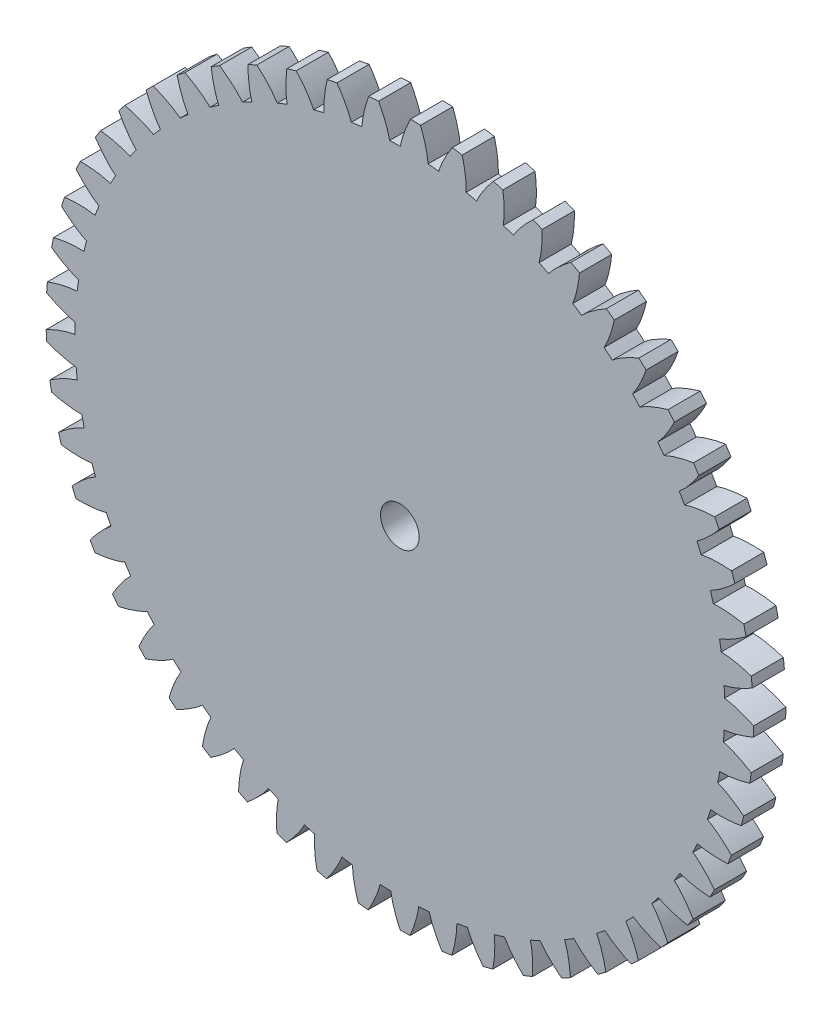
from build123d import *

# Parameters (mm, degrees)
EXTRUDE_1_DEPTH     = 5
SKETCH_3_R          = 3
CUT_EXTRUDE_1_DEPTH = 10


with BuildPart() as part:
    # 草图2 → 凸台-拉伸1 (new body)
    with BuildSketch(Plane.XY):
        with BuildLine():
            ThreePointArc((6.050445487, 50.136235493), (5.224631296, 50.229007832), (4.39740234, 50.308178785))
            add(Edge.make_bspline(
                [(4.39740234, 50.308178785), (4.39433391, 50.347031472), (4.379480718, 50.521134839), (4.321791187, 51.034505691), (4.196292667, 51.746210415), (3.988817446, 52.610724903), (3.696242823, 53.584892052), (3.473195651, 54.222326614), (3.305652379, 54.661100667), (3.207731405, 54.90637904)],
                knots=[0.023341811, 0.023341811, 0.023341811, 0.023341811, 0.023341811, 0.02853182, 0.046610139, 0.092110525, 0.119476175, 0.146842495, 0.182010624, 0.182010624, 0.182010624, 0.182010624, 0.182010624], degree=4))
            ThreePointArc((3.207731405, 54.90637904), (2.43944874, 54.945874184), (1.670688816, 54.974619588))
            add(Edge.make_bspline(
                [(0.078206442, 50.499939443), (0.084705921, 50.538367341), (0.114929701, 50.710469412), (0.217887143, 51.216707971), (0.405963113, 51.914490833), (0.689235239, 52.757217461), (1.066989355, 53.70162382), (1.345648358, 54.31678398), (1.551416558, 54.73898401), (1.670688816, 54.974619588)],
                knots=[0.023341811, 0.023341811, 0.023341811, 0.023341811, 0.023341811, 0.02853182, 0.046610139, 0.092110525, 0.119476175, 0.146842495, 0.182010624, 0.182010624, 0.182010624, 0.182010624, 0.182010624], degree=4))
            ThreePointArc((0.078206442, 50.499939443), (-0.752783918, 50.494388959), (-1.583570433, 50.475165227))
            add(Edge.make_bspline(
                [(-1.583570433, 50.475165227), (-1.591212556, 50.513382298), (-1.626553252, 50.684506916), (-1.744555864, 51.187451344), (-1.953349097, 51.879317572), (-2.261616939, 52.713225364), (-2.667355847, 53.645951198), (-2.964228879, 54.252531172), (-3.182491379, 54.668409639), (-3.308734907, 54.900385002)],
                knots=[0.023341811, 0.023341811, 0.023341811, 0.023341811, 0.023341811, 0.02853182, 0.046610139, 0.092110525, 0.119476175, 0.146842495, 0.182010624, 0.182010624, 0.182010624, 0.182010624, 0.182010624], degree=4))
            ThreePointArc((-3.308734907, 54.900385002), (-4.076296285, 54.848735706), (-4.843060167, 54.786355676))
            add(Edge.make_bspline(
                [(-5.895130451, 50.154734941), (-5.89322158, 50.193661831), (-5.883564995, 50.368130596), (-5.841204642, 50.882993019), (-5.736977751, 51.598122551), (-5.555365835, 52.468437655), (-5.291961073, 53.450893493), (-5.088014895, 54.094693786), (-4.933625898, 54.538267293), (-4.843060167, 54.786355676)],
                knots=[0.023341811, 0.023341811, 0.023341811, 0.023341811, 0.023341811, 0.02853182, 0.046610139, 0.092110525, 0.119476175, 0.146842495, 0.182010624, 0.182010624, 0.182010624, 0.182010624, 0.182010624], degree=4))
            ThreePointArc((-5.895130451, 50.154734941), (-6.719631696, 50.05093955), (-7.542313348, 49.933590992))
            add(Edge.make_bspline(
                [(-7.542313348, 49.933590992), (-7.554421887, 49.970635963), (-7.609753981, 50.136379618), (-7.786413176, 50.621837383), (-8.075570122, 51.284152832), (-8.480303181, 52.07574769), (-8.993510687, 52.953938784), (-9.360042134, 53.521149116), (-9.625959935, 53.908293973), (-9.778753833, 54.123709901)],
                knots=[0.023341811, 0.023341811, 0.023341811, 0.023341811, 0.023341811, 0.02853182, 0.046610139, 0.092110525, 0.119476175, 0.146842495, 0.182010624, 0.182010624, 0.182010624, 0.182010624, 0.182010624], degree=4))
            ThreePointArc((-9.778753833, 54.123709901), (-10.534819046, 53.98164121), (-11.288823202, 53.829011422))
            add(Edge.make_bspline(
                [(-11.785712635, 49.1054679), (-11.788421168, 49.144347334), (-11.799467337, 49.318733635), (-11.818298718, 49.834992381), (-11.799384022, 50.557429733), (-11.72198175, 51.443115995), (-11.576623969, 52.449829787), (-11.450253571, 53.113232669), (-11.34941106, 53.571952852), (-11.288823202, 53.829011422)],
                knots=[0.023341811, 0.023341811, 0.023341811, 0.023341811, 0.023341811, 0.02853182, 0.046610139, 0.092110525, 0.119476175, 0.146842495, 0.182010624, 0.182010624, 0.182010624, 0.182010624, 0.182010624], degree=4))
            ThreePointArc((-11.785712635, 49.1054679), (-12.592150574, 48.904884663), (-13.395178717, 48.691058595))
            add(Edge.make_bspline(
                [(-13.395178717, 48.691058595), (-13.411583693, 48.726411436), (-13.486130444, 48.88444745), (-13.718966315, 49.345603791), (-14.084427844, 49.969071002), (-14.579944554, 50.707240669), (-15.193416352, 51.518569145), (-15.624460914, 52.038447446), (-15.934301114, 52.391424029), (-16.111500491, 52.587256555)],
                knots=[0.023341811, 0.023341811, 0.023341811, 0.023341811, 0.023341811, 0.02853182, 0.046610139, 0.092110525, 0.119476175, 0.146842495, 0.182010624, 0.182010624, 0.182010624, 0.182010624, 0.182010624], degree=4))
            ThreePointArc((-16.111500491, 52.587256555), (-16.84545604, 52.356762799), (-17.576115904, 52.116025843))
            add(Edge.make_bspline(
                [(-17.510849248, 47.366867731), (-17.518137164, 47.405153927), (-17.549731021, 47.577009762), (-17.629489786, 48.08741769), (-17.696152807, 48.807021424), (-17.724046737, 49.695645752), (-17.69877644, 50.712485442), (-17.651755786, 51.386178191), (-17.60587537, 51.853605624), (-17.576115904, 52.116025843)],
                knots=[0.023341811, 0.023341811, 0.023341811, 0.023341811, 0.023341811, 0.02853182, 0.046610139, 0.092110525, 0.119476175, 0.146842495, 0.182010624, 0.182010624, 0.182010624, 0.182010624, 0.182010624], degree=4))
            ThreePointArc((-17.510849248, 47.366867731), (-18.287903261, 47.072312396), (-19.060005139, 46.765010468))
            add(Edge.make_bspline(
                [(-19.060005139, 46.765010468), (-19.080476263, 46.798174902), (-19.173191198, 46.946284795), (-19.458935239, 47.376666088), (-19.895571072, 47.952532948), (-20.474915466, 48.626915141), (-21.180039756, 49.359991725), (-21.669546512, 49.825240043), (-22.018959633, 50.139093335), (-22.218076998, 50.312593399)],
                knots=[0.023341811, 0.023341811, 0.023341811, 0.023341811, 0.023341811, 0.02853182, 0.046610139, 0.092110525, 0.119476175, 0.146842495, 0.182010624, 0.182010624, 0.182010624, 0.182010624, 0.182010624], degree=4))
            ThreePointArc((-22.218076998, 50.312593399), (-22.919619757, 49.996910207), (-23.616678467, 49.671445501))
            add(Edge.make_bspline(
                [(-22.990171921, 44.963340568), (-23.001936914, 45.000496072), (-23.053634952, 45.167408962), (-23.193201461, 45.664801064), (-23.344506396, 46.371469521), (-23.477304959, 47.250557577), (-23.572476886, 48.263248965), (-23.605466043, 48.937774411), (-23.615191782, 49.407347438), (-23.616678467, 49.671445501)],
                knots=[0.023341811, 0.023341811, 0.023341811, 0.023341811, 0.023341811, 0.02853182, 0.046610139, 0.092110525, 0.119476175, 0.146842495, 0.182010624, 0.182010624, 0.182010624, 0.182010624, 0.182010624], degree=4))
            ThreePointArc((-22.990171921, 44.963340568), (-23.726933874, 44.578948047), (-24.45727087, 44.182484104))
            add(Edge.make_bspline(
                [(-24.45727087, 44.182484104), (-24.481520771, 44.212994575), (-24.591102376, 44.34909921), (-24.925743367, 44.742663844), (-25.427424095, 45.262846446), (-26.082463446, 45.863974316), (-26.869341828, 46.508508221), (-27.410439178, 46.912595489), (-27.794520225, 47.182919677), (-28.012760408, 47.331651718)],
                knots=[0.023341811, 0.023341811, 0.023341811, 0.023341811, 0.023341811, 0.02853182, 0.046610139, 0.092110525, 0.119476175, 0.146842495, 0.182010624, 0.182010624, 0.182010624, 0.182010624, 0.182010624], degree=4))
            ThreePointArc((-28.012760408, 47.331651718), (-28.672042253, 46.935210589), (-29.325714632, 46.529586946))
            add(Edge.make_bspline(
                [(-28.146762976, 41.928626665), (-28.162839891, 41.964129895), (-28.233916382, 42.123756748), (-28.431331428, 42.601150729), (-28.665154288, 43.284963834), (-28.900993282, 44.142175148), (-29.115271428, 45.136502267), (-29.227807301, 45.802391551), (-29.293002667, 46.267518396), (-29.325714632, 46.529586946)],
                knots=[0.023341811, 0.023341811, 0.023341811, 0.023341811, 0.023341811, 0.02853182, 0.046610139, 0.092110525, 0.119476175, 0.146842495, 0.182010624, 0.182010624, 0.182010624, 0.182010624, 0.182010624], degree=4))
            ThreePointArc((-28.146762976, 41.928626665), (-28.832890345, 41.459792985), (-29.511210128, 40.979732513))
            add(Edge.make_bspline(
                [(-29.511210128, 40.979732513), (-29.538898392, 41.007160721), (-29.66380838, 41.129349487), (-30.042648695, 41.480572677), (-30.602331821, 41.937768796), (-31.323870813, 42.457203827), (-32.18145724, 43.004147208), (-32.766549361, 43.341400928), (-33.17990668, 43.564401253), (-33.414206066, 43.686277399)],
                knots=[0.023341811, 0.023341811, 0.023341811, 0.023341811, 0.023341811, 0.02853182, 0.046610139, 0.092110525, 0.119476175, 0.146842495, 0.182010624, 0.182010624, 0.182010624, 0.182010624, 0.182010624], degree=4))
            ThreePointArc((-33.414206066, 43.686277399), (-34.021972125, 43.214643499), (-34.623082046, 42.734554983))
            add(Edge.make_bspline(
                [(-32.908235177, 38.305326751), (-32.92839833, 38.33867932), (-33.017855515, 38.488779326), (-33.270347825, 38.939473621), (-33.583406248, 39.590832136), (-33.918975011, 40.414133341), (-34.249351381, 41.376138017), (-34.439854212, 42.024043514), (-34.559604005, 42.478194816), (-34.623082046, 42.734554983)],
                knots=[0.023341811, 0.023341811, 0.023341811, 0.023341811, 0.023341811, 0.02853182, 0.046610139, 0.092110525, 0.119476175, 0.146842495, 0.182010624, 0.182010624, 0.182010624, 0.182010624, 0.182010624], degree=4))
            ThreePointArc((-32.908235177, 38.305326751), (-33.534096238, 37.758633311), (-34.150876685, 37.201715305))
            add(Edge.make_bspline(
                [(-34.150876685, 37.201715305), (-34.181614629, 37.225676219), (-34.320099539, 37.332233853), (-34.737821091, 37.636185196), (-35.347649889, 38.023976802), (-36.125559696, 38.454427263), (-37.041815534, 38.896102235), (-37.662689017, 39.161788103), (-38.099519976, 39.334334129), (-38.346589515, 39.427643507)],
                knots=[0.023341811, 0.023341811, 0.023341811, 0.023341811, 0.023341811, 0.02853182, 0.046610139, 0.092110525, 0.119476175, 0.146842495, 0.182010624, 0.182010624, 0.182010624, 0.182010624, 0.182010624], degree=4))
            ThreePointArc((-38.346589515, 39.427643507), (-38.894308086, 38.887437541), (-39.434417283, 38.339623544))
            add(Edge.make_bspline(
                [(-37.207747892, 34.144304017), (-37.231714235, 34.175037727), (-37.338296333, 34.313503811), (-37.642321467, 34.731171659), (-38.0302208, 35.340931939), (-38.460808682, 36.11876569), (-38.902645515, 37.034943487), (-39.168441063, 37.655770024), (-39.341064258, 38.092570493), (-39.434417283, 38.339623544)],
                knots=[0.023341811, 0.023341811, 0.023341811, 0.023341811, 0.023341811, 0.02853182, 0.046610139, 0.092110525, 0.119476175, 0.146842495, 0.182010624, 0.182010624, 0.182010624, 0.182010624, 0.182010624], degree=4))
            ThreePointArc((-37.207747892, 34.144304017), (-37.764556927, 33.527425193), (-38.311139793, 32.901467562))
            add(Edge.make_bspline(
                [(-38.311139793, 32.901467562), (-38.344495924, 32.921624822), (-38.494611731, 33.011055489), (-38.945350624, 33.263468174), (-39.596764435, 33.576411522), (-40.420124909, 33.911834834), (-41.382187936, 34.242041248), (-42.030127077, 34.432429617), (-42.484299527, 34.552099176), (-42.740670905, 34.615531927)],
                knots=[0.023341811, 0.023341811, 0.023341811, 0.023341811, 0.023341811, 0.02853182, 0.046610139, 0.092110525, 0.119476175, 0.146842495, 0.182010624, 0.182010624, 0.182010624, 0.182010624, 0.182010624], degree=4))
            ThreePointArc((-42.740670905, 34.615531927), (-43.220653219, 34.014337202), (-43.692179743, 33.406487832))
            add(Edge.make_bspline(
                [(-40.984945387, 29.503970099), (-41.012378486, 29.531653517), (-41.134589317, 29.656541918), (-41.485879428, 30.035320179), (-41.943174416, 30.594922526), (-42.462736907, 31.316369743), (-43.009831783, 32.173859532), (-43.34718886, 32.758892065), (-43.570262207, 33.172209981), (-43.692179743, 33.406487832)],
                knots=[0.023341811, 0.023341811, 0.023341811, 0.023341811, 0.023341811, 0.02853182, 0.046610139, 0.092110525, 0.119476175, 0.146842495, 0.182010624, 0.182010624, 0.182010624, 0.182010624, 0.182010624], degree=4))
            ThreePointArc((-40.984945387, 29.503970099), (-41.464886019, 28.825565518), (-41.933598478, 28.139355335))
            add(Edge.make_bspline(
                [(-41.933598478, 28.139355335), (-41.969104548, 28.155425978), (-42.128743955, 28.226474267), (-42.606172804, 28.423804974), (-43.290027206, 28.657507026), (-44.147280171, 28.893194579), (-45.141645129, 29.107297062), (-45.807554284, 29.219715295), (-46.272692639, 29.28482849), (-46.534766964, 29.317494157)],
                knots=[0.023341811, 0.023341811, 0.023341811, 0.023341811, 0.023341811, 0.02853182, 0.046610139, 0.092110525, 0.119476175, 0.146842495, 0.182010624, 0.182010624, 0.182010624, 0.182010624, 0.182010624], degree=4))
            ThreePointArc((-46.534766964, 29.317494157), (-46.940275122, 28.66375013), (-47.336599774, 28.004398259))
            add(Edge.make_bspline(
                [(-44.186804089, 24.449465115), (-44.217318843, 24.473709626), (-44.353442835, 24.583267184), (-44.747066581, 24.917838642), (-45.267337803, 25.419427466), (-45.868581385, 26.07436061), (-46.513254291, 26.861125116), (-46.917437144, 27.40215107), (-47.18782918, 27.786184355), (-47.336599774, 28.004398259)],
                knots=[0.023341811, 0.023341811, 0.023341811, 0.023341811, 0.023341811, 0.02853182, 0.046610139, 0.092110525, 0.119476175, 0.146842495, 0.182010624, 0.182010624, 0.182010624, 0.182010624, 0.182010624], degree=4))
            ThreePointArc((-44.186804089, 24.449465115), (-44.583139002, 23.71905809), (-44.96740136, 22.982228242))
            add(Edge.make_bspline(
                [(-44.96740136, 22.982228242), (-45.004558942, 22.993986671), (-45.171480962, 23.04565522), (-45.668897712, 23.185133857), (-46.375592889, 23.336313948), (-47.254704391, 23.468957207), (-48.267412576, 23.563950228), (-48.94194384, 23.596820222), (-49.411518578, 23.606463005), (-49.6756169, 23.607903034)],
                knots=[0.023341811, 0.023341811, 0.023341811, 0.023341811, 0.023341811, 0.02853182, 0.046610139, 0.092110525, 0.119476175, 0.146842495, 0.182010624, 0.182010624, 0.182010624, 0.182010624, 0.182010624], degree=4))
            ThreePointArc((-49.6756169, 23.607903034), (-50.000958456, 22.910786837), (-50.316517707, 22.20918832))
            add(Edge.make_bspline(
                [(-46.76837692, 19.051743234), (-46.80154497, 19.072208499), (-46.94967124, 19.164897267), (-47.380103006, 19.450565271), (-47.956046995, 19.887099364), (-48.630531525, 20.466324611), (-49.363732667, 21.171319383), (-49.829067455, 21.66074394), (-50.14298247, 22.010101609), (-50.316517707, 22.20918832)],
                knots=[0.023341811, 0.023341811, 0.023341811, 0.023341811, 0.023341811, 0.02853182, 0.046610139, 0.092110525, 0.119476175, 0.146842495, 0.182010624, 0.182010624, 0.182010624, 0.182010624, 0.182010624], degree=4))
            ThreePointArc((-46.76837692, 19.051743234), (-47.075542442, 18.27958708), (-47.369960496, 17.502481041))
            add(Edge.make_bspline(
                [(-47.369960496, 17.502481041), (-47.408247979, 17.509762194), (-47.580109393, 17.54132569), (-48.090531403, 17.620994284), (-48.810146903, 17.687530177), (-49.698776145, 17.71526712), (-50.715611355, 17.689817187), (-51.389295786, 17.642677517), (-51.856715107, 17.596714526), (-52.119130065, 17.566908701)],
                knots=[0.023341811, 0.023341811, 0.023341811, 0.023341811, 0.023341811, 0.02853182, 0.046610139, 0.092110525, 0.119476175, 0.146842495, 0.182010624, 0.182010624, 0.182010624, 0.182010624, 0.182010624], degree=4))
            ThreePointArc((-52.119130065, 17.566908701), (-52.359737937, 16.836206318), (-52.590102026, 16.102210061))
            add(Edge.make_bspline(
                [(-48.693424257, 13.386576641), (-48.728779995, 13.402975371), (-48.886829176, 13.477494202), (-49.348026643, 13.7102486), (-49.971558407, 14.07559998), (-50.709815602, 14.570986276), (-51.521252443, 15.184314734), (-52.041206885, 15.615267446), (-52.3942382, 15.925045283), (-52.590102026, 16.102210061)],
                knots=[0.023341811, 0.023341811, 0.023341811, 0.023341811, 0.023341811, 0.02853182, 0.046610139, 0.092110525, 0.119476175, 0.146842495, 0.182010624, 0.182010624, 0.182010624, 0.182010624, 0.182010624], degree=4))
            ThreePointArc((-48.693424257, 13.386576641), (-48.907108456, 12.583510736), (-49.107549223, 11.777037373))
            add(Edge.make_bspline(
                [(-49.107549223, 11.777037373), (-49.146429135, 11.779739038), (-49.320817385, 11.790754399), (-49.83707945, 11.809494576), (-50.559513448, 11.790452254), (-51.445186023, 11.712893516), (-52.45187412, 11.567357888), (-53.115254667, 11.440870294), (-53.573957027, 11.339946747), (-53.83100489, 11.279313477)],
                knots=[0.023341811, 0.023341811, 0.023341811, 0.023341811, 0.023341811, 0.02853182, 0.046610139, 0.092110525, 0.119476175, 0.146842495, 0.182010624, 0.182010624, 0.182010624, 0.182010624, 0.182010624], degree=4))
            ThreePointArc((-53.83100489, 11.279313477), (-53.983501471, 10.525282368), (-54.125436592, 9.769192069))
            add(Edge.make_bspline(
                [(-49.934922654, 7.533491855), (-49.971969763, 7.545593849), (-50.137723191, 7.600896661), (-50.623212158, 7.777470092), (-51.285578679, 8.066510027), (-52.077245026, 8.471103234), (-52.95552677, 8.98415559), (-53.522801846, 9.350586826), (-53.909993675, 9.616436229), (-54.125436592, 9.769192069)],
                knots=[0.023341811, 0.023341811, 0.023341811, 0.023341811, 0.023341811, 0.02853182, 0.046610139, 0.092110525, 0.119476175, 0.146842495, 0.182010624, 0.182010624, 0.182010624, 0.182010624, 0.182010624], degree=4))
            ThreePointArc((-49.934922654, 7.533491855), (-50.052125874, 6.710789484), (-50.155775604, 5.886269916))
            add(Edge.make_bspline(
                [(-50.155775604, 5.886269916), (-50.194702157, 5.884354167), (-50.369169213, 5.874666761), (-50.884024144, 5.832215452), (-51.599135252, 5.727862226), (-52.469418259, 5.546096561), (-53.451827548, 5.282518241), (-54.095591802, 5.07845833), (-54.539138027, 4.923990973), (-54.787210406, 4.833381416)],
                knots=[0.023341811, 0.023341811, 0.023341811, 0.023341811, 0.023341811, 0.02853182, 0.046610139, 0.092110525, 0.119476175, 0.146842495, 0.182010624, 0.182010624, 0.182010624, 0.182010624, 0.182010624], degree=4))
            ThreePointArc((-54.787210406, 4.833381416), (-54.849454978, 4.066606526), (-54.900968673, 3.299036035))
            add(Edge.make_bspline(
                [(-50.475444196, 1.574653357), (-50.513662617, 1.582288729), (-50.684793476, 1.617599193), (-51.187758742, 1.735512952), (-51.879661846, 1.944183954), (-52.713624084, 2.252304472), (-53.646421582, 2.657878596), (-54.253053992, 2.954644464), (-54.668971011, 3.172833491), (-54.900968673, 3.299036035)],
                knots=[0.023341811, 0.023341811, 0.023341811, 0.023341811, 0.023341811, 0.02853182, 0.046610139, 0.092110525, 0.119476175, 0.146842495, 0.182010624, 0.182010624, 0.182010624, 0.182010624, 0.182010624], degree=4))
            ThreePointArc((-50.475444196, 1.574653357), (-50.49452116, 0.743863459), (-50.499924839, -0.087127868))
            add(Edge.make_bspline(
                [(-50.499924839, -0.087127868), (-50.538351588, -0.093634137), (-50.710448317, -0.12388832), (-51.21666868, -0.226935193), (-51.914418304, -0.415134433), (-52.757094876, -0.698555432), (-53.701434485, -1.076476383), (-54.316545407, -1.355244057), (-54.738709079, -1.561086841), (-54.974323583, -1.680400725)],
                knots=[0.023341811, 0.023341811, 0.023341811, 0.023341811, 0.023341811, 0.02853182, 0.046610139, 0.092110525, 0.119476175, 0.146842495, 0.182010624, 0.182010624, 0.182010624, 0.182010624, 0.182010624], degree=4))
            ThreePointArc((-54.974323583, -1.680400725), (-54.945442368, -2.449155559), (-54.905811498, -3.217431234))
            add(Edge.make_bspline(
                [(-50.307401145, -4.406289823), (-50.346254374, -4.403228256), (-50.520360362, -4.388405823), (-51.033741398, -4.330806986), (-51.745468281, -4.205434199), (-52.610019409, -3.998111708), (-53.584238229, -3.705709188), (-54.221712185, -3.48277463), (-54.66051583, -3.315308876), (-54.905811498, -3.217431234)],
                knots=[0.023341811, 0.023341811, 0.023341811, 0.023341811, 0.023341811, 0.02853182, 0.046610139, 0.092110525, 0.119476175, 0.146842495, 0.182010624, 0.182010624, 0.182010624, 0.182010624, 0.182010624], degree=4))
            ThreePointArc((-50.307401145, -4.406289823), (-50.228084054, -5.233504779), (-50.135165826, -6.059302568))
            add(Edge.make_bspline(
                [(-50.135165826, -6.059302568), (-50.172553344, -6.070308023), (-50.339863884, -6.120704282), (-50.830343455, -6.282900166), (-51.500936721, -6.552303513), (-52.304177527, -6.933401238), (-53.197190998, -7.420359638), (-53.775013778, -7.769921788), (-54.169868645, -8.024250417), (-54.389717762, -8.170593723)],
                knots=[0.023341811, 0.023341811, 0.023341811, 0.023341811, 0.023341811, 0.02853182, 0.046610139, 0.092110525, 0.119476175, 0.146842495, 0.182010624, 0.182010624, 0.182010624, 0.182010624, 0.182010624], degree=4))
            ThreePointArc((-54.389717762, -8.170593723), (-54.27011619, -8.930536868), (-54.139897085, -9.688732821))
            add(Edge.make_bspline(
                [(-49.433152458, -10.325378352), (-49.47209508, -10.326933569), (-49.646732132, -10.33280724), (-50.163322192, -10.336331886), (-50.88488177, -10.296017274), (-51.767885385, -10.192403163), (-52.76984963, -10.017276938), (-53.429216394, -9.871303202), (-53.884746825, -9.756911572), (-54.139897085, -9.688732821)],
                knots=[0.023341811, 0.023341811, 0.023341811, 0.023341811, 0.023341811, 0.02853182, 0.046610139, 0.092110525, 0.119476175, 0.146842495, 0.182010624, 0.182010624, 0.182010624, 0.182010624, 0.182010624], degree=4))
            ThreePointArc((-49.433152458, -10.325378352), (-49.256554749, -11.137406082), (-49.066618982, -11.946417942))
            add(Edge.make_bspline(
                [(-49.066618982, -11.946417942), (-49.102442431, -11.961768091), (-49.26261811, -12.031598971), (-49.730471629, -12.250666992), (-50.364494878, -12.597492615), (-51.117024177, -13.070917289), (-51.946175558, -13.66007731), (-52.478598832, -14.075526848), (-52.840601997, -14.374771107), (-53.041599527, -14.546089495)],
                knots=[0.023341811, 0.023341811, 0.023341811, 0.023341811, 0.023341811, 0.02853182, 0.046610139, 0.092110525, 0.119476175, 0.146842495, 0.182010624, 0.182010624, 0.182010624, 0.182010624, 0.182010624], degree=4))
            ThreePointArc((-53.041599527, -14.546089495), (-52.832956542, -15.286553015), (-52.613977192, -16.024025837))
            add(Edge.make_bspline(
                [(-47.864970668, -16.099521202), (-47.903456016, -16.105671371), (-48.076172609, -16.132158693), (-48.588719902, -16.196757345), (-49.30998306, -16.242066837), (-50.199043726, -16.243615621), (-51.214688014, -16.188224078), (-51.886691524, -16.121260315), (-52.35255409, -16.061548618), (-52.613977192, -16.024025837)],
                knots=[0.023341811, 0.023341811, 0.023341811, 0.023341811, 0.023341811, 0.02853182, 0.046610139, 0.092110525, 0.119476175, 0.146842495, 0.182010624, 0.182010624, 0.182010624, 0.182010624, 0.182010624], degree=4))
            ThreePointArc((-47.864970668, -16.099521202), (-47.593571388, -16.884962617), (-47.309284364, -17.665831795))
            add(Edge.make_bspline(
                [(-47.309284364, -17.665831795), (-47.34304086, -17.685311156), (-47.493833161, -17.773596385), (-47.932492993, -18.046461308), (-48.521045926, -18.465840535), (-49.212299858, -19.024946313), (-49.965949681, -19.708037439), (-50.445499393, -20.183542366), (-50.769569125, -20.52350152), (-50.948893504, -20.717390056)],
                knots=[0.023341811, 0.023341811, 0.023341811, 0.023341811, 0.023341811, 0.02853182, 0.046610139, 0.092110525, 0.119476175, 0.146842495, 0.182010624, 0.182010624, 0.182010624, 0.182010624, 0.182010624], degree=4))
            ThreePointArc((-50.948893504, -20.717390056), (-50.654137995, -21.427979466), (-50.349472391, -22.134376656))
            add(Edge.make_bspline(
                [(-45.624869612, -21.647662066), (-45.662357434, -21.658320851), (-45.830729007, -21.70505), (-46.332038492, -21.829815834), (-47.042880276, -21.960113384), (-47.925517532, -22.066803321), (-48.940584443, -22.131924036), (-49.615791241, -22.144910272), (-50.085446255, -22.140716729), (-50.349472391, -22.134376656)],
                knots=[0.023341811, 0.023341811, 0.023341811, 0.023341811, 0.023341811, 0.02853182, 0.046610139, 0.092110525, 0.119476175, 0.146842495, 0.182010624, 0.182010624, 0.182010624, 0.182010624, 0.182010624], degree=4))
            ThreePointArc((-45.624869612, -21.647662066), (-45.26247861, -22.395491289), (-44.887831096, -23.137256094))
            add(Edge.make_bspline(
                [(-44.887831096, -23.137256094), (-44.919046773, -23.160591219), (-45.058338903, -23.266091466), (-45.461647224, -23.588922865), (-45.99646785, -24.074968532), (-46.616742723, -24.711906794), (-47.284311397, -25.479339924), (-47.70425572, -26.008225192), (-47.985842791, -26.38412696), (-48.140976697, -26.597863874)],
                knots=[0.023341811, 0.023341811, 0.023341811, 0.023341811, 0.023341811, 0.02853182, 0.046610139, 0.092110525, 0.119476175, 0.146842495, 0.182010624, 0.182010624, 0.182010624, 0.182010624, 0.182010624], degree=4))
            ThreePointArc((-48.140976697, -26.597863874), (-47.764246386, -27.268604057), (-47.378171365, -27.934009345))
            add(Edge.make_bspline(
                [(-42.744295397, -26.891917206), (-42.780259448, -26.906934982), (-42.941922432, -26.973249983), (-43.424956823, -27.15643156), (-44.115398572, -27.369888076), (-44.979222125, -27.580221474), (-45.979462346, -27.764940295), (-46.648394008, -27.857694231), (-47.115248542, -27.909077709), (-47.378171365, -27.934009345)],
                knots=[0.023341811, 0.023341811, 0.023341811, 0.023341811, 0.023341811, 0.02853182, 0.046610139, 0.092110525, 0.119476175, 0.146842495, 0.182010624, 0.182010624, 0.182010624, 0.182010624, 0.182010624], degree=4))
            ThreePointArc((-42.744295397, -26.891917206), (-42.295999849, -27.591636355), (-41.836251074, -28.283884034))
            add(Edge.make_bspline(
                [(-41.836251074, -28.283884034), (-41.864487732, -28.310747349), (-41.990324336, -28.431981622), (-42.352619581, -28.800247652), (-42.82620019, -29.346136743), (-43.366788705, -30.051966273), (-43.938905029, -30.892968327), (-44.293348865, -31.467809547), (-44.52850041, -31.874377093), (-44.657266103, -32.104961987)],
                knots=[0.023341811, 0.023341811, 0.023341811, 0.023341811, 0.023341811, 0.02853182, 0.046610139, 0.092110525, 0.119476175, 0.146842495, 0.182010624, 0.182010624, 0.182010624, 0.182010624, 0.182010624], degree=4))
            ThreePointArc((-44.657266103, -32.104961987), (-44.203849458, -32.72643722), (-43.741784668, -33.341509775))
            add(Edge.make_bspline(
                [(-39.263684971, -31.758668777), (-39.297620394, -31.777834727), (-39.450305396, -31.862804663), (-39.908283949, -32.101830515), (-40.568633375, -32.395449535), (-41.401517035, -32.706473773), (-42.372889385, -33.008197654), (-43.026155578, -33.179417228), (-43.483656018, -33.285656416), (-43.741784668, -33.341509775)],
                knots=[0.023341811, 0.023341811, 0.023341811, 0.023341811, 0.023341811, 0.02853182, 0.046610139, 0.092110525, 0.119476175, 0.146842495, 0.182010624, 0.182010624, 0.182010624, 0.182010624, 0.182010624], degree=4))
            ThreePointArc((-39.263684971, -31.758668777), (-38.735777965, -32.400455328), (-38.197381794, -33.033468242))
            add(Edge.make_bspline(
                [(-38.197381794, -33.033468242), (-38.222243052, -33.063482645), (-38.332857659, -33.19874908), (-38.649053997, -33.607280094), (-39.054746556, -34.205349522), (-39.508060036, -34.97016202), (-39.97669275, -35.872927173), (-40.260660485, -36.485654834), (-40.446075491, -36.91718084), (-40.546665384, -37.161376808)],
                knots=[0.023341811, 0.023341811, 0.023341811, 0.023341811, 0.023341811, 0.02853182, 0.046610139, 0.092110525, 0.119476175, 0.146842495, 0.182010624, 0.182010624, 0.182010624, 0.182010624, 0.182010624], degree=4))
            ThreePointArc((-40.546665384, -37.161376808), (-40.02292738, -37.724862941), (-39.491359196, -38.280968494))
            add(Edge.make_bspline(
                [(-35.231898476, -36.179598253), (-35.263328892, -36.202643329), (-35.404892548, -36.305075409), (-35.831386249, -36.596590138), (-36.452373492, -36.966249894), (-37.242625399, -37.373598875), (-38.17149394, -37.788092273), (-38.799924239, -38.035373937), (-39.241648281, -38.19497747), (-39.491359196, -38.280968494)],
                knots=[0.023341811, 0.023341811, 0.023341811, 0.023341811, 0.023341811, 0.02853182, 0.046610139, 0.092110525, 0.119476175, 0.146842495, 0.182010624, 0.182010624, 0.182010624, 0.182010624, 0.182010624], degree=4))
            ThreePointArc((-35.231898476, -36.179598253), (-34.631790667, -36.754442931), (-34.022305003, -37.319334965))
            add(Edge.make_bspline(
                [(-34.022305003, -37.319334965), (-34.043441864, -37.35207912), (-34.137281687, -37.499478874), (-34.402940415, -37.942539991), (-34.735049889, -38.584394172), (-35.094724806, -39.397453348), (-35.453295335, -40.349308756), (-35.662800685, -40.991321505), (-35.795876331, -41.441748292), (-35.866878362, -41.696127357)],
                knots=[0.023341811, 0.023341811, 0.023341811, 0.023341811, 0.023341811, 0.02853182, 0.046610139, 0.092110525, 0.119476175, 0.146842495, 0.182010624, 0.182010624, 0.182010624, 0.182010624, 0.182010624], degree=4))
            ThreePointArc((-35.866878362, -41.696127357), (-35.280171133, -42.193714281), (-34.686561608, -42.683046328))
            add(Edge.make_bspline(
                [(-30.705533355, -40.092645477), (-30.73401755, -40.119246177), (-30.862472617, -40.237702479), (-31.251494428, -40.577613856), (-31.824402191, -41.018125136), (-32.560928939, -41.516080572), (-33.434254393, -42.037524908), (-34.029027013, -42.35739737), (-34.448773821, -42.568124765), (-34.686561608, -42.683046328)],
                knots=[0.023341811, 0.023341811, 0.023341811, 0.023341811, 0.023341811, 0.02853182, 0.046610139, 0.092110525, 0.119476175, 0.146842495, 0.182010624, 0.182010624, 0.182010624, 0.182010624, 0.182010624], degree=4))
            ThreePointArc((-30.705533355, -40.092645477), (-30.041648943, -40.592478722), (-29.369629628, -41.081320031))
            add(Edge.make_bspline(
                [(-29.369629628, -41.081320031), (-29.386745376, -41.116334281), (-29.462493111, -41.273798184), (-29.673884962, -41.745169798), (-29.927749263, -42.421798507), (-30.188736569, -43.271690791), (-30.432211368, -44.259274491), (-30.564313336, -44.921559876), (-30.643181533, -45.384564439), (-30.683598989, -45.645555678)],
                knots=[0.023341811, 0.023341811, 0.023341811, 0.023341811, 0.023341811, 0.02853182, 0.046610139, 0.092110525, 0.119476175, 0.146842495, 0.182010624, 0.182010624, 0.182010624, 0.182010624, 0.182010624], degree=4))
            ThreePointArc((-30.683598989, -45.645555678), (-30.042158618, -46.070258362), (-29.394840729, -46.485947753))
            add(Edge.make_bspline(
                [(-25.748129854, -43.442879843), (-25.773267971, -43.472662751), (-25.886811223, -43.605480407), (-26.23290013, -43.989016822), (-26.749686042, -44.494195814), (-27.422148412, -45.075767503), (-28.227671203, -45.696842841), (-28.780436841, -46.084815793), (-29.172314089, -46.343708899), (-29.394840729, -46.485947753)],
                knots=[0.023341811, 0.023341811, 0.023341811, 0.023341811, 0.023341811, 0.02853182, 0.046610139, 0.092110525, 0.119476175, 0.146842495, 0.182010624, 0.182010624, 0.182010624, 0.182010624, 0.182010624], degree=4))
            ThreePointArc((-25.748129854, -43.442879843), (-25.029788319, -43.860685091), (-24.304669032, -44.266613415))
            add(Edge.make_bspline(
                [(-24.304669032, -44.266613415), (-24.3175234, -44.303406238), (-24.374115713, -44.468723841), (-24.52827321, -44.961788927), (-24.700328638, -45.66369378), (-24.858964644, -46.538488548), (-24.983925862, -47.547937029), (-25.036770026, -48.221198016), (-25.060323637, -48.690280786), (-25.069589145, -48.954220453)],
                knots=[0.023341811, 0.023341811, 0.023341811, 0.023341811, 0.023341811, 0.02853182, 0.046610139, 0.092110525, 0.119476175, 0.146842495, 0.182010624, 0.182010624, 0.182010624, 0.182010624, 0.182010624], degree=4))
            ThreePointArc((-25.069589145, -48.954220453), (-24.382420049, -49.300077003), (-23.69048072, -49.636288371))
            add(Edge.make_bspline(
                [(-20.429279049, -46.183271404), (-20.450718206, -46.215818433), (-20.547755743, -46.361132975), (-20.846053418, -46.782910417), (-21.299462938, -47.345665515), (-21.898421031, -48.002689465), (-22.624833385, -48.71467727), (-23.127832423, -49.165304421), (-23.486339014, -49.468728946), (-23.69048072, -49.636288371)],
                knots=[0.023341811, 0.023341811, 0.023341811, 0.023341811, 0.023341811, 0.02853182, 0.046610139, 0.092110525, 0.119476175, 0.146842495, 0.182010624, 0.182010624, 0.182010624, 0.182010624, 0.182010624], degree=4))
            ThreePointArc((-20.429279049, -46.183271404), (-19.666564334, -46.513183586), (-18.898524159, -46.83050058))
            add(Edge.make_bspline(
                [(-18.898524159, -46.83050058), (-18.9069367, -46.868555484), (-18.94357916, -47.039406091), (-19.038338269, -47.547243098), (-19.126169544, -48.264570888), (-19.180227348, -49.151987939), (-19.184920802, -50.169130758), (-19.157765346, -50.843916237), (-19.12567373, -51.312492321), (-19.103657223, -51.575675281)],
                knots=[0.023341811, 0.023341811, 0.023341811, 0.023341811, 0.023341811, 0.02853182, 0.046610139, 0.092110525, 0.119476175, 0.146842495, 0.182010624, 0.182010624, 0.182010624, 0.182010624, 0.182010624], degree=4))
            ThreePointArc((-19.103657223, -51.575675281), (-18.38040575, -51.83783063), (-17.653558292, -52.089844304))
            add(Edge.make_bspline(
                [(-14.823645949, -48.275351069), (-14.841085185, -48.310205331), (-14.920254814, -48.465976861), (-15.16657381, -48.9200745), (-15.550242063, -49.532505855), (-16.067287821, -50.25575889), (-16.7043925, -51.048664413), (-17.150563934, -51.555619947), (-17.470667221, -51.899316476), (-17.653558292, -52.089844304)],
                knots=[0.023341811, 0.023341811, 0.023341811, 0.023341811, 0.023341811, 0.02853182, 0.046610139, 0.092110525, 0.119476175, 0.146842495, 0.182010624, 0.182010624, 0.182010624, 0.182010624, 0.182010624], degree=4))
            ThreePointArc((-14.823645949, -48.275351069), (-14.027264895, -48.512738941), (-13.227085433, -48.736990171))
            add(Edge.make_bspline(
                [(-13.227085433, -48.736990171), (-13.230938053, -48.775772949), (-13.24711628, -48.949758192), (-13.281146791, -49.4652382), (-13.283520954, -50.187919219), (-13.232241703, -51.075501162), (-13.116601508, -52.086059863), (-13.009827635, -52.752897326), (-12.922541287, -53.214388942), (-12.869551829, -53.473120684)],
                knots=[0.023341811, 0.023341811, 0.023341811, 0.023341811, 0.023341811, 0.02853182, 0.046610139, 0.092110525, 0.119476175, 0.146842495, 0.182010624, 0.182010624, 0.182010624, 0.182010624, 0.182010624], degree=4))
            ThreePointArc((-12.869551829, -53.473120684), (-12.120370845, -53.647894745), (-11.368818603, -53.812173006))
            add(Edge.make_bspline(
                [(-9.009921353, -49.689750625), (-9.023115861, -49.726422843), (-9.083306212, -49.890464671), (-9.274188752, -50.37050797), (-9.582729876, -51.024018389), (-10.010605109, -51.803347622), (-10.549458562, -52.666040209), (-10.932539123, -53.222207581), (-11.209745557, -53.601351367), (-11.368818603, -53.812173006)],
                knots=[0.023341811, 0.023341811, 0.023341811, 0.023341811, 0.023341811, 0.02853182, 0.046610139, 0.092110525, 0.119476175, 0.146842495, 0.182010624, 0.182010624, 0.182010624, 0.182010624, 0.182010624], degree=4))
            ThreePointArc((-9.009921353, -49.689750625), (-8.191053405, -49.831281783), (-7.369967422, -49.959319253))
            add(Edge.make_bspline(
                [(-7.369967422, -49.959319253), (-7.369206038, -49.99828548), (-7.364692925, -50.172962987), (-7.337517124, -50.688849786), (-7.254400848, -51.406739177), (-7.09850439, -52.282026308), (-6.86415388, -53.271814862), (-6.679260462, -53.921343373), (-6.538004692, -54.36927219), (-6.454786138, -54.619920688)],
                knots=[0.023341811, 0.023341811, 0.023341811, 0.023341811, 0.023341811, 0.02853182, 0.046610139, 0.092110525, 0.119476175, 0.146842495, 0.182010624, 0.182010624, 0.182010624, 0.182010624, 0.182010624], degree=4))
            ThreePointArc((-6.454786138, -54.619920688), (-5.690192501, -54.704860015), (-4.924485621, -54.779096756))
            add(Edge.make_bspline(
                [(-3.069717211, -50.406615005), (-3.078481769, -50.444590379), (-3.118847903, -50.614599718), (-3.251614413, -51.113849923), (-3.480697167, -51.799265552), (-3.813395445, -52.623730908), (-4.24643335, -53.544100245), (-4.561045426, -54.141672084), (-4.791463638, -54.55094078), (-4.924485621, -54.779096756)],
                knots=[0.023341811, 0.023341811, 0.023341811, 0.023341811, 0.023341811, 0.02853182, 0.046610139, 0.092110525, 0.119476175, 0.146842495, 0.182010624, 0.182010624, 0.182010624, 0.182010624, 0.182010624], degree=4))
            ThreePointArc((-3.069717211, -50.406615005), (-2.23985748, -50.45030266), (-1.409391223, -50.480329004))
            add(Edge.make_bspline(
                [(-1.409391223, -50.480329004), (-1.404026524, -50.51893168), (-1.378885426, -50.691849363), (-1.290884801, -51.200901033), (-1.123444856, -51.903921202), (-0.865119636, -52.754626408), (-0.515348579, -53.709750354), (-0.254931113, -54.332851955), (-0.061688842, -54.760930035), (0.050590601, -54.999976733)],
                knots=[0.023341811, 0.023341811, 0.023341811, 0.023341811, 0.023341811, 0.02853182, 0.046610139, 0.092110525, 0.119476175, 0.146842495, 0.182010624, 0.182010624, 0.182010624, 0.182010624, 0.182010624], degree=4))
            ThreePointArc((0.050590601, -54.999976733), (0.819863673, -54.993888966), (1.588976344, -54.977042065))
            add(Edge.make_bspline(
                [(2.913579031, -50.415881002), (2.909367459, -50.454626443), (2.889392195, -50.628216733), (2.816605465, -51.139665465), (2.670196901, -51.847364571), (2.437345931, -52.705392364), (2.116202478, -53.670518483), (1.87447535, -54.301106191), (1.694079928, -54.734754562), (1.588976344, -54.977042065)],
                knots=[0.023341811, 0.023341811, 0.023341811, 0.023341811, 0.023341811, 0.02853182, 0.046610139, 0.092110525, 0.119476175, 0.146842495, 0.182010624, 0.182010624, 0.182010624, 0.182010624, 0.182010624], degree=4))
            ThreePointArc((2.913579031, -50.415881002), (3.742781134, -50.361111876), (4.570969739, -50.292705591))
            add(Edge.make_bspline(
                [(4.570969739, -50.292705591), (4.580862445, -50.330402818), (4.626278603, -50.499133291), (4.773868714, -50.994203864), (5.02328184, -51.672485948), (5.380409502, -52.486667193), (5.840691087, -53.393718683), (6.17297691, -53.981646395), (6.415492984, -54.38386446), (6.55525716, -54.607953666)],
                knots=[0.023341811, 0.023341811, 0.023341811, 0.023341811, 0.023341811, 0.02853182, 0.046610139, 0.092110525, 0.119476175, 0.146842495, 0.182010624, 0.182010624, 0.182010624, 0.182010624, 0.182010624], degree=4))
            ThreePointArc((6.55525716, -54.607953666), (7.318410758, -54.510924263), (8.080132565, -54.403230214))
            add(Edge.make_bspline(
                [(8.855975011, -49.717418543), (8.856375545, -49.75639015), (8.857071559, -49.931124564), (8.845286376, -50.447592204), (8.783607257, -51.167640243), (8.653872314, -52.047185644), (8.449131462, -53.04352029), (8.283682601, -53.698271797), (8.155842326, -54.15021237), (8.080132565, -54.403230214)],
                knots=[0.023341811, 0.023341811, 0.023341811, 0.023341811, 0.023341811, 0.02853182, 0.046610139, 0.092110525, 0.119476175, 0.146842495, 0.182010624, 0.182010624, 0.182010624, 0.182010624, 0.182010624], degree=4))
            ThreePointArc((8.855975011, -49.717418543), (9.672879306, -49.564961474), (10.487164306, -49.399082834))
            add(Edge.make_bspline(
                [(10.487164306, -49.399082834), (10.501446146, -49.435345426), (10.56649982, -49.597520083), (10.771607578, -50.071659853), (11.099492669, -50.715682259), (11.550409485, -51.481910223), (12.114740253, -52.328156243), (12.514229868, -52.872656849), (12.802615351, -53.243368638), (12.967902277, -53.449354632)],
                knots=[0.023341811, 0.023341811, 0.023341811, 0.023341811, 0.023341811, 0.02853182, 0.046610139, 0.092110525, 0.119476175, 0.146842495, 0.182010624, 0.182010624, 0.182010624, 0.182010624, 0.182010624], degree=4))
            ThreePointArc((12.967902277, -53.449354632), (13.714223398, -53.262745673), (14.457861436, -53.065716265))
            add(Edge.make_bspline(
                [(14.674052513, -48.32103251), (14.679059532, -48.359683206), (14.700417054, -48.533108856), (14.749798855, -49.04734533), (14.773715021, -49.769634406), (14.748917299, -50.658350526), (14.663453161, -51.671907344), (14.576605107, -52.341631375), (14.503114575, -52.805519895), (14.457861436, -53.065716265)],
                knots=[0.023341811, 0.023341811, 0.023341811, 0.023341811, 0.023341811, 0.02853182, 0.046610139, 0.092110525, 0.119476175, 0.146842495, 0.182010624, 0.182010624, 0.182010624, 0.182010624, 0.182010624], degree=4))
            ThreePointArc((14.674052513, -48.32103251), (15.467191455, -48.073027661), (16.256142074, -47.812005238))
            add(Edge.make_bspline(
                [(16.256142074, -47.812005238), (16.274612563, -47.846324148), (16.358390543, -47.999666412), (16.618136682, -48.446219496), (17.019890952, -49.046941561), (17.558267037, -49.754460083), (18.218725022, -50.528021194), (18.679810471, -51.021451098), (19.010017062, -51.355452632), (19.198506472, -51.540443821)],
                knots=[0.023341811, 0.023341811, 0.023341811, 0.023341811, 0.023341811, 0.02853182, 0.046610139, 0.092110525, 0.119476175, 0.146842495, 0.182010624, 0.182010624, 0.182010624, 0.182010624, 0.182010624], degree=4))
            ThreePointArc((19.198506472, -51.540443821), (19.917518403, -51.266874887), (20.632633625, -50.983275981))
            add(Edge.make_bspline(
                [(20.286138485, -46.246325101), (20.2956817, -46.284112316), (20.337400918, -46.453794686), (20.447256491, -46.958581242), (20.556432211, -47.672971999), (20.636919815, -48.558383211), (20.671932121, -49.574934086), (20.664904029, -50.250229182), (20.646794886, -50.719553672), (20.632633625, -50.983275981)],
                knots=[0.023341811, 0.023341811, 0.023341811, 0.023341811, 0.023341811, 0.02853182, 0.046610139, 0.092110525, 0.119476175, 0.146842495, 0.182010624, 0.182010624, 0.182010624, 0.182010624, 0.182010624], degree=4))
            ThreePointArc((20.286138485, -46.246325101), (21.04437814, -45.906253917), (21.796919241, -45.553751894))
            add(Edge.make_bspline(
                [(21.796919241, -45.553751894), (21.819319094, -45.585645359), (21.92064532, -45.728002641), (22.231383575, -46.140700412), (22.701367274, -46.689689315), (23.319645008, -47.328566386), (24.066958827, -48.018583486), (24.583167481, -48.454016015), (24.950559805, -48.746618644), (25.159605719, -48.908018157)],
                knots=[0.023341811, 0.023341811, 0.023341811, 0.023341811, 0.023341811, 0.02853182, 0.046610139, 0.092110525, 0.119476175, 0.146842495, 0.182010624, 0.182010624, 0.182010624, 0.182010624, 0.182010624], degree=4))
            ThreePointArc((25.159605719, -48.908018157), (25.84121511, -48.551329556), (26.517768864, -48.185142258))
            add(Edge.make_bspline(
                [(25.61345154, -43.522420661), (25.627396986, -43.558813945), (25.688892252, -43.722371066), (25.857679466, -44.210621607), (26.050582152, -44.907085566), (26.235225213, -45.776762637), (26.390222466, -46.782037422), (26.463112997, -47.453423922), (26.500639456, -47.921596094), (26.517768864, -48.185142258)],
                knots=[0.023341811, 0.023341811, 0.023341811, 0.023341811, 0.023341811, 0.02853182, 0.046610139, 0.092110525, 0.119476175, 0.146842495, 0.182010624, 0.182010624, 0.182010624, 0.182010624, 0.182010624], degree=4))
            ThreePointArc((25.61345154, -43.522420661), (26.326147887, -43.095056996), (27.031715442, -42.656023728))
            add(Edge.make_bspline(
                [(27.031715442, -42.656023728), (27.057730213, -42.685044035), (27.175182287, -42.814417951), (27.532550575, -43.187467037), (28.064166161, -43.677016177), (28.75366628, -44.238283363), (29.577345286, -44.835070124), (30.141430707, -45.20639276), (30.54085138, -45.453488984), (30.767519253, -45.589031126)],
                knots=[0.023341811, 0.023341811, 0.023341811, 0.023341811, 0.023341811, 0.02853182, 0.046610139, 0.092110525, 0.119476175, 0.146842495, 0.182010624, 0.182010624, 0.182010624, 0.182010624, 0.182010624], degree=4))
            ThreePointArc((30.767519253, -45.589031126), (31.402157801, -45.154229984), (32.030652757, -44.710594762))
            add(Edge.make_bspline(
                [(30.581207881, -40.187556838), (30.599359794, -40.222045308), (30.67976785, -40.377181198), (30.905117302, -40.842041755), (31.179039024, -41.510802088), (31.465245558, -42.352536659), (31.738051937, -43.332423501), (31.889837866, -43.990476609), (31.982473137, -44.450924353), (32.030652757, -44.710594762)],
                knots=[0.023341811, 0.023341811, 0.023341811, 0.023341811, 0.023341811, 0.02853182, 0.046610139, 0.092110525, 0.119476175, 0.146842495, 0.182010624, 0.182010624, 0.182010624, 0.182010624, 0.182010624], degree=4))
            ThreePointArc((30.581207881, -40.187556838), (31.238356224, -39.67889994), (31.887045612, -39.159498492))
            add(Edge.make_bspline(
                [(31.887045612, -39.159498492), (31.916310112, -39.185238259), (32.048239264, -39.299812682), (32.447220916, -39.627976292), (33.033005673, -40.051213473), (33.784049107, -40.526991813), (34.672530651, -41.022170657), (35.276574316, -41.324170844), (35.702416348, -41.522291973), (35.94352426, -41.63007403)],
                knots=[0.023341811, 0.023341811, 0.023341811, 0.023341811, 0.023341811, 0.02853182, 0.046610139, 0.092110525, 0.119476175, 0.146842495, 0.182010624, 0.182010624, 0.182010624, 0.182010624, 0.182010624], degree=4))
            ThreePointArc((35.94352426, -41.63007403), (36.522283031, -41.123264002), (37.093896497, -40.608408522))
            add(Edge.make_bspline(
                [(35.119671097, -36.288547808), (35.141774665, -36.320647323), (35.239966758, -36.465184213), (35.518715037, -36.900129165), (35.869810533, -37.531797942), (36.253562827, -38.333773905), (36.640348729, -39.274517339), (36.868899315, -39.909999433), (37.015343003, -40.356259071), (37.093896497, -40.608408522)],
                knots=[0.023341811, 0.023341811, 0.023341811, 0.023341811, 0.023341811, 0.02853182, 0.046610139, 0.092110525, 0.119476175, 0.146842495, 0.182010624, 0.182010624, 0.182010624, 0.182010624, 0.182010624], degree=4))
            ThreePointArc((35.119671097, -36.288547808), (35.712046516, -35.705738106), (36.294751559, -35.113259736))
            add(Edge.make_bspline(
                [(36.294751559, -35.113259736), (36.326854978, -35.135357633), (36.471409212, -35.23352419), (36.906403402, -35.512195626), (37.538134195, -35.863179525), (38.340177939, -36.246790135), (39.280989689, -36.633409836), (39.91651215, -36.861848153), (40.362797651, -37.008213002), (40.614960976, -37.086721949)],
                knots=[0.023341811, 0.023341811, 0.023341811, 0.023341811, 0.023341811, 0.02853182, 0.046610139, 0.092110525, 0.119476175, 0.146842495, 0.182010624, 0.182010624, 0.182010624, 0.182010624, 0.182010624], degree=4))
            ThreePointArc((40.614960976, -37.086721949), (41.129715466, -36.515017537), (41.636423241, -35.936169241))
            add(Edge.make_bspline(
                [(39.165131115, -31.880127113), (39.190876052, -31.909387065), (39.30547378, -32.041295974), (39.63370787, -32.440219646), (40.05704853, -33.025929624), (40.532959544, -33.776888994), (41.028295341, -34.665283045), (41.330402235, -35.269273349), (41.528598591, -35.695080373), (41.636423241, -35.936169241)],
                knots=[0.023341811, 0.023341811, 0.023341811, 0.023341811, 0.023341811, 0.02853182, 0.046610139, 0.092110525, 0.119476175, 0.146842495, 0.182010624, 0.182010624, 0.182010624, 0.182010624, 0.182010624], degree=4))
            ThreePointArc((39.165131115, -31.880127113), (39.684417956, -31.231345977), (40.192958753, -30.574107783))
            add(Edge.make_bspline(
                [(40.192958753, -30.574107783), (40.227450429, -30.592253603), (40.382600522, -30.672634251), (40.847500883, -30.897901577), (41.516309597, -31.17170515), (42.358094716, -31.457762976), (43.338029737, -31.730396242), (43.99610965, -31.882065916), (44.456573752, -31.974619842), (44.716252668, -32.022753587)],
                knots=[0.023341811, 0.023341811, 0.023341811, 0.023341811, 0.023341811, 0.02853182, 0.046610139, 0.092110525, 0.119476175, 0.146842495, 0.182010624, 0.182010624, 0.182010624, 0.182010624, 0.182010624], degree=4))
            ThreePointArc((44.716252668, -32.022753587), (45.159776852, -31.394180268), (45.594465871, -30.759464917))
            add(Edge.make_bspline(
                [(42.660798543, -27.024179315), (42.689823446, -27.050188959), (42.819218109, -27.167618176), (43.192330323, -27.524920554), (43.681973372, -28.056449648), (44.243362358, -28.745850601), (44.840294622, -29.569424164), (45.211716905, -30.133443978), (45.458883687, -30.532820992), (45.594465871, -30.759464917)],
                knots=[0.023341811, 0.023341811, 0.023341811, 0.023341811, 0.023341811, 0.02853182, 0.046610139, 0.092110525, 0.119476175, 0.146842495, 0.182010624, 0.182010624, 0.182010624, 0.182010624, 0.182010624], degree=4))
            ThreePointArc((42.660798543, -27.024179315), (43.099707157, -26.31853421), (43.52694491, -25.605762376))
            add(Edge.make_bspline(
                [(43.52694491, -25.605762376), (43.563340656, -25.619701392), (43.726908639, -25.681167763), (44.21518899, -25.849868719), (44.911687017, -26.042648363), (45.781396694, -26.227137782), (46.786698846, -26.381957439), (47.458098212, -26.45472936), (47.926277007, -26.49217311), (48.189826193, -26.50925596)],
                knots=[0.023341811, 0.023341811, 0.023341811, 0.023341811, 0.023341811, 0.02853182, 0.046610139, 0.092110525, 0.119476175, 0.146842495, 0.182010624, 0.182010624, 0.182010624, 0.182010624, 0.182010624], degree=4))
            ThreePointArc((48.189826193, -26.50925596), (48.555893963, -25.832637524), (48.912462144, -25.150965131))
            add(Edge.make_bspline(
                [(45.557601874, -21.788871277), (45.589499296, -21.811265495), (45.731874476, -21.91256657), (46.144627136, -22.223231913), (46.693699059, -22.693118619), (47.332685347, -23.311283477), (48.022834457, -24.058475385), (48.458358175, -24.574607106), (48.751025703, -24.941947733), (48.912462144, -25.150965131)],
                knots=[0.023341811, 0.023341811, 0.023341811, 0.023341811, 0.023341811, 0.02853182, 0.046610139, 0.092110525, 0.119476175, 0.146842495, 0.182010624, 0.182010624, 0.182010624, 0.182010624, 0.182010624], degree=4))
            ThreePointArc((45.557601874, -21.788871277), (45.909970946, -21.036267914), (46.249908173, -20.277968193))
            add(Edge.make_bspline(
                [(46.249908173, -20.277968193), (46.287697073, -20.287504733), (46.45738681, -20.329193973), (46.962192765, -20.438960367), (47.676602799, -20.54800988), (48.562028216, -20.628341064), (49.57858526, -20.663173783), (50.253879105, -20.656026393), (50.723200388, -20.637834338), (50.986920191, -20.623626487)],
                knots=[0.023341811, 0.023341811, 0.023341811, 0.023341811, 0.023341811, 0.02853182, 0.046610139, 0.092110525, 0.119476175, 0.146842495, 0.182010624, 0.182010624, 0.182010624, 0.182010624, 0.182010624], degree=4))
            ThreePointArc((50.986920191, -20.623626487), (51.270392759, -19.908461176), (51.543834666, -19.189400926))
            add(Edge.make_bspline(
                [(47.814876337, -16.247695249), (47.84919851, -16.266159674), (48.002555572, -16.349910563), (48.449154535, -16.60957781), (49.049947566, -17.011225948), (49.757561188, -17.549477032), (50.531238965, -18.209798349), (51.024750318, -18.67079662), (51.358810182, -19.000944201), (51.543834666, -19.189400926)],
                knots=[0.023341811, 0.023341811, 0.023341811, 0.023341811, 0.023341811, 0.02853182, 0.046610139, 0.092110525, 0.119476175, 0.146842495, 0.182010624, 0.182010624, 0.182010624, 0.182010624, 0.182010624], degree=4))
            ThreePointArc((47.814876337, -16.247695249), (48.075759378, -15.458698529), (48.323624106, -14.665515787))
            add(Edge.make_bspline(
                [(48.323624106, -14.665515787), (48.362275686, -14.670515977), (48.535705106, -14.691842861), (49.049950296, -14.741133815), (49.772243586, -14.76492238), (50.660955311, -14.739967655), (51.674497015, -14.654324462), (52.344205692, -14.567358094), (52.808081223, -14.493785611), (53.068269594, -14.448486507)],
                knots=[0.023341811, 0.023341811, 0.023341811, 0.023341811, 0.023341811, 0.02853182, 0.046610139, 0.092110525, 0.119476175, 0.146842495, 0.182010624, 0.182010624, 0.182010624, 0.182010624, 0.182010624], degree=4))
            ThreePointArc((53.068269594, -14.448486507), (53.265167626, -13.704813672), (53.451644735, -12.958459596))
            add(Edge.make_bspline(
                [(49.400934748, -10.478437194), (49.437199863, -10.492712628), (49.599386009, -10.557737651), (50.073562007, -10.762761642), (50.717642327, -11.090532954), (51.48394994, -11.541314399), (52.330295643, -12.105495659), (52.874866814, -12.504889075), (53.245629545, -12.793209063), (53.451644735, -12.958459596)],
                knots=[0.023341811, 0.023341811, 0.023341811, 0.023341811, 0.023341811, 0.02853182, 0.046610139, 0.092110525, 0.119476175, 0.146842495, 0.182010624, 0.182010624, 0.182010624, 0.182010624, 0.182010624], degree=4))
            ThreePointArc((49.400934748, -10.478437194), (49.566669532, -9.664122902), (49.718982283, -8.847191686))
            add(Edge.make_bspline(
                [(49.718982283, -8.847191686), (49.75795396, -8.847585336), (49.932688494, -8.848250481), (50.449154044, -8.836374057), (51.169191175, -8.774567734), (52.048713644, -8.644677411), (53.045012104, -8.439760548), (53.699734372, -8.27419602), (54.151652354, -8.146275905), (54.404656819, -8.070521447)],
                knots=[0.023341811, 0.023341811, 0.023341811, 0.023341811, 0.023341811, 0.02853182, 0.046610139, 0.092110525, 0.119476175, 0.146842495, 0.182010624, 0.182010624, 0.182010624, 0.182010624, 0.182010624], degree=4))
            ThreePointArc((54.404656819, -8.070521447), (54.512216298, -7.308780626), (54.60911088, -6.545609899))
            add(Edge.make_bspline(
                [(50.293512323, -4.56208485), (50.331211298, -4.571970896), (50.499949791, -4.617357245), (50.99504643, -4.764859894), (51.673372565, -5.014153189), (52.487616889, -5.371137011), (53.394749679, -5.831258347), (53.982736084, -6.163440299), (54.384996986, -6.405885313), (54.60911088, -6.545609899)],
                knots=[0.023341811, 0.023341811, 0.023341811, 0.023341811, 0.023341811, 0.02853182, 0.046610139, 0.092110525, 0.119476175, 0.146842495, 0.182010624, 0.182010624, 0.182010624, 0.182010624, 0.182010624], degree=4))
            ThreePointArc((50.293512323, -4.56208485), (50.361772298, -3.733884173), (50.416394935, -2.904672408))
            add(Edge.make_bspline(
                [(50.416394935, -2.904672408), (50.455139631, -2.90045399), (50.628726389, -2.88044806), (51.140162255, -2.807570977), (51.847835485, -2.661037392), (52.705822129, -2.428034845), (53.670891499, -2.106720896), (54.301436493, -1.86488237), (54.735052988, -1.684410342), (54.977321919, -1.579263957)],
                knots=[0.023341811, 0.023341811, 0.023341811, 0.023341811, 0.023341811, 0.02853182, 0.046610139, 0.092110525, 0.119476175, 0.146842495, 0.182010624, 0.182010624, 0.182010624, 0.182010624, 0.182010624], degree=4))
            ThreePointArc((54.977321919, -1.579263957), (54.994032946, -0.810148321), (54.999984812, -0.040874186))
            add(Edge.make_bspline(
                [(50.480079231, 1.418309164), (50.518682853, 1.412951285), (50.691604975, 1.387840736), (51.200672184, 1.299930043), (51.903721922, 1.132614297), (52.754472751, 0.874439368), (53.709658473, 0.524837051), (54.33280607, 0.264529668), (54.760918282, 0.071363025), (54.999984812, -0.040874186)],
                knots=[0.023341811, 0.023341811, 0.023341811, 0.023341811, 0.023341811, 0.02853182, 0.046610139, 0.092110525, 0.119476175, 0.146842495, 0.182010624, 0.182010624, 0.182010624, 0.182010624, 0.182010624], degree=4))
            ThreePointArc((50.480079231, 1.418309164), (50.449906175, 2.248770104), (50.406071915, 3.078622105))
            add(Edge.make_bspline(
                [(50.406071915, 3.078622105), (50.444045741, 3.087393371), (50.614047945, 3.127789538), (51.113274688, 3.260644245), (51.798649836, 3.489848082), (52.623056404, 3.822692008), (53.543349225, 4.2558925), (54.140865475, 4.57061014), (54.550093459, 4.80110065), (54.778225931, 4.934162937)],
                knots=[0.023341811, 0.023341811, 0.023341811, 0.023341811, 0.023341811, 0.02853182, 0.046610139, 0.092110525, 0.119476175, 0.146842495, 0.182010624, 0.182010624, 0.182010624, 0.182010624, 0.182010624], degree=4))
            ThreePointArc((54.778225931, 4.934162937), (54.70385392, 5.69985669), (54.618779519, 6.46443531))
            add(Edge.make_bspline(
                [(49.958016479, 7.378793228), (49.99698284, 7.378038728), (50.171661142, 7.373556474), (50.687552734, 7.346471811), (51.405456797, 7.26348236), (52.280771455, 7.107740535), (53.270601395, 6.873564887), (53.920162559, 6.688786219), (54.368116323, 6.547609583), (54.618779519, 6.46443531)],
                knots=[0.023341811, 0.023341811, 0.023341811, 0.023341811, 0.023341811, 0.02853182, 0.046610139, 0.092110525, 0.119476175, 0.146842495, 0.182010624, 0.182010624, 0.182010624, 0.182010624, 0.182010624], degree=4))
            ThreePointArc((49.958016479, 7.378793228), (49.829833956, 8.199856578), (49.688158138, 9.018699511))
            add(Edge.make_bspline(
                [(49.688158138, 9.018699511), (49.724828023, 9.031900497), (49.888859216, 9.092119828), (50.368868786, 9.28308717), (51.022324687, 9.591743739), (51.801578318, 10.019756644), (52.664175697, 10.558762493), (53.220275384, 10.941941302), (53.599370192, 11.219214713), (53.810163726, 11.378325)],
                knots=[0.023341811, 0.023341811, 0.023341811, 0.023341811, 0.023341811, 0.02853182, 0.046610139, 0.092110525, 0.119476175, 0.146842495, 0.182010624, 0.182010624, 0.182010624, 0.182010624, 0.182010624], degree=4))
            ThreePointArc((53.810163726, 11.378325), (53.645752697, 12.129848208), (53.470846287, 12.878998305))
            add(Edge.make_bspline(
                [(48.734652685, 13.235695208), (48.773434782, 13.239554679), (48.947417164, 13.255763643), (49.462891152, 13.289885219), (50.18557174, 13.292387053), (51.073162729, 13.241264604), (52.083741843, 13.125802938), (52.750598159, 13.019146873), (53.212105188, 12.931942054), (53.470846287, 12.878998305)],
                knots=[0.023341811, 0.023341811, 0.023341811, 0.023341811, 0.023341811, 0.02853182, 0.046610139, 0.092110525, 0.119476175, 0.146842495, 0.182010624, 0.182010624, 0.182010624, 0.182010624, 0.182010624], degree=4))
            ThreePointArc((48.734652685, 13.235695208), (48.510260097, 14.035835041), (48.272731538, 14.832174145))
            add(Edge.make_bspline(
                [(48.272731538, 14.832174145), (48.307582719, 14.849619539), (48.463340261, 14.928816685), (48.917394377, 15.175215899), (49.529757943, 15.558992339), (50.252919624, 16.07616586), (51.045712583, 16.713410607), (51.552589287, 17.159671594), (51.89622926, 17.479835594), (52.086724776, 17.662760321)],
                knots=[0.023341811, 0.023341811, 0.023341811, 0.023341811, 0.023341811, 0.02853182, 0.046610139, 0.092110525, 0.119476175, 0.146842495, 0.182010624, 0.182010624, 0.182010624, 0.182010624, 0.182010624], degree=4))
            ThreePointArc((52.086724776, 17.662760321), (51.834582699, 18.389563246), (51.572299583, 19.112768395))
            add(Edge.make_bspline(
                [(46.827161196, 18.906797041), (46.865214613, 18.915216305), (47.036058744, 18.951888947), (47.543879002, 19.04673777), (48.261191265, 19.134695768), (49.148598752, 19.188910345), (50.165740726, 19.193783489), (50.840530992, 19.166747243), (51.309112737, 19.134738407), (51.572299583, 19.112768395)],
                knots=[0.023341811, 0.023341811, 0.023341811, 0.023341811, 0.023341811, 0.02853182, 0.046610139, 0.092110525, 0.119476175, 0.146842495, 0.182010624, 0.182010624, 0.182010624, 0.182010624, 0.182010624], degree=4))
            ThreePointArc((46.827161196, 18.906797041), (46.509708523, 19.674781146), (46.179661602, 20.437437567))
            add(Edge.make_bspline(
                [(46.179661602, 20.437437567), (46.212204844, 20.458882473), (46.357502241, 20.55594568), (46.779226979, 20.854317862), (47.341901967, 21.307826793), (47.998820093, 21.906900948), (48.710679558, 22.633439072), (49.161217841, 23.13651771), (49.464579027, 23.495077899), (49.632102385, 23.699249204)],
                knots=[0.023341811, 0.023341811, 0.023341811, 0.023341811, 0.023341811, 0.02853182, 0.046610139, 0.092110525, 0.119476175, 0.146842495, 0.182010624, 0.182010624, 0.182010624, 0.182010624, 0.182010624], degree=4))
            ThreePointArc((49.632102385, 23.699249204), (49.295768783, 24.391129127), (48.949790841, 25.078237112))
            add(Edge.make_bspline(
                [(44.262319009, 24.312488888), (44.29910956, 24.325349756), (44.464417163, 24.381971273), (44.957455008, 24.536215874), (45.659329454, 24.708395299), (46.534096183, 24.867185846), (47.543522573, 24.992325393), (48.216774214, 25.045288496), (48.685852815, 25.068924976), (48.949790841, 25.078237112)],
                knots=[0.023341811, 0.023341811, 0.023341811, 0.023341811, 0.023341811, 0.02853182, 0.046610139, 0.092110525, 0.119476175, 0.146842495, 0.182010624, 0.182010624, 0.182010624, 0.182010624, 0.182010624], degree=4))
            ThreePointArc((44.262319009, 24.312488888), (43.856262591, 25.037536452), (43.438330445, 25.755804165))
            add(Edge.make_bspline(
                [(43.438330445, 25.755804165), (43.468108911, 25.780947543), (43.600906507, 25.894514257), (43.984381775, 26.240670915), (44.489469462, 26.757546065), (45.070922343, 27.430111166), (45.691855367, 28.235743665), (46.07973066, 28.788577834), (46.338554532, 29.180500813), (46.480754072, 29.403052578)],
                knots=[0.023341811, 0.023341811, 0.023341811, 0.023341811, 0.023341811, 0.02853182, 0.046610139, 0.092110525, 0.119476175, 0.146842495, 0.182010624, 0.182010624, 0.182010624, 0.182010624, 0.182010624], degree=4))
            ThreePointArc((46.480754072, 29.403052578), (46.064950331, 30.05029702), (45.640134335, 30.691662352))
            add(Edge.make_bspline(
                [(41.076130888, 29.376886684), (41.111142114, 29.394008618), (41.268592632, 29.469784169), (41.739926894, 29.681259291), (42.416510744, 29.935243122), (43.266356908, 30.196380568), (44.25389758, 30.440029832), (44.916159618, 30.572248799), (45.379150241, 30.65119879), (45.640134335, 30.691662352)],
                knots=[0.023341811, 0.023341811, 0.023341811, 0.023341811, 0.023341811, 0.02853182, 0.046610139, 0.092110525, 0.119476175, 0.146842495, 0.182010624, 0.182010624, 0.182010624, 0.182010624, 0.182010624], degree=4))
            ThreePointArc((41.076130888, 29.376886684), (40.587170866, 30.048819629), (40.087220346, 30.712615729))
            add(Edge.make_bspline(
                [(40.087220346, 30.712615729), (40.113816013, 30.741104623), (40.23224962, 30.869580615), (40.572092266, 31.258662469), (41.012502328, 31.831648045), (41.510327641, 32.568262752), (42.031617685, 33.441680311), (42.351385068, 34.036509431), (42.562038306, 34.45629346), (42.676917859, 34.694101546)],
                knots=[0.023341811, 0.023341811, 0.023341811, 0.023341811, 0.023341811, 0.02853182, 0.046610139, 0.092110525, 0.119476175, 0.146842495, 0.182010624, 0.182010624, 0.182010624, 0.182010624, 0.182010624], degree=4))
            ThreePointArc((42.676917859, 34.694101546), (42.187480952, 35.287624615), (41.689790387, 35.87424393))
            add(Edge.make_bspline(
                [(37.313323929, 34.028897387), (37.346064349, 34.050040032), (37.493447523, 34.143905894), (37.936461702, 34.409642889), (38.578257201, 34.74186575), (39.391252823, 35.101684297), (40.343044871, 35.460422978), (40.985020598, 35.670041743), (41.435423869, 35.803196961), (41.689790387, 35.87424393)],
                knots=[0.023341811, 0.023341811, 0.023341811, 0.023341811, 0.023341811, 0.02853182, 0.046610139, 0.092110525, 0.119476175, 0.146842495, 0.182010624, 0.182010624, 0.182010624, 0.182010624, 0.182010624], degree=4))
            ThreePointArc((37.313323929, 34.028897387), (36.748324231, 34.638283246), (36.173373546, 35.238289492))
            add(Edge.make_bspline(
                [(36.173373546, 35.238289492), (36.196413069, 35.269723978), (36.298820138, 35.411305728), (36.590259517, 35.837850922), (36.959809562, 36.458903461), (37.367018929, 37.249227318), (37.781348224, 38.17816907), (38.028518865, 38.806643044), (38.18804436, 39.248395276), (38.273991268, 39.498121378)],
                knots=[0.023341811, 0.023341811, 0.023341811, 0.023341811, 0.023341811, 0.02853182, 0.046610139, 0.092110525, 0.119476175, 0.146842495, 0.182010624, 0.182010624, 0.182010624, 0.182010624, 0.182010624], degree=4))
            ThreePointArc((38.273991268, 39.498121378), (37.717791816, 40.029591311), (37.154213167, 40.55322976))
            add(Edge.make_bspline(
                [(33.026719694, 38.203216962), (33.056729705, 38.228083522), (33.191976597, 38.338722024), (33.600451744, 38.654990529), (34.198449492, 39.060788737), (34.963181895, 39.514237324), (35.865864244, 39.983029515), (36.47854173, 40.267105492), (36.910034973, 40.452596728), (37.154213167, 40.55322976)],
                knots=[0.023341811, 0.023341811, 0.023341811, 0.023341811, 0.023341811, 0.02853182, 0.046610139, 0.092110525, 0.119476175, 0.146842495, 0.182010624, 0.182010624, 0.182010624, 0.182010624, 0.182010624], degree=4))
            ThreePointArc((33.026719694, 38.203216962), (32.393611676, 38.741501295), (31.751731874, 39.269294914))
            add(Edge.make_bspline(
                [(31.751731874, 39.269294914), (31.770891828, 39.303233722), (31.85583479, 39.455933732), (32.094779731, 39.913954505), (32.388282087, 40.574355792), (32.699159182, 41.407294385), (33.000711453, 42.378720023), (33.171815617, 43.032016454), (33.27797398, 43.489535656), (33.333781737, 43.747674168)],
                knots=[0.023341811, 0.023341811, 0.023341811, 0.023341811, 0.023341811, 0.02853182, 0.046610139, 0.092110525, 0.119476175, 0.146842495, 0.182010624, 0.182010624, 0.182010624, 0.182010624, 0.182010624], degree=4))
            ThreePointArc((33.333781737, 43.747674168), (32.718627562, 44.209630291), (32.097072237, 44.662937138))
            add(Edge.make_bspline(
                [(28.27649271, 41.841247113), (28.303351037, 41.869488517), (28.424563077, 41.995346536), (28.792765098, 42.357706834), (29.338570516, 42.831383874), (30.044304533, 43.372097074), (30.885205503, 43.944361962), (31.459984098, 44.298907345), (31.866510094, 44.534130711), (32.097072237, 44.662937138)],
                knots=[0.023341811, 0.023341811, 0.023341811, 0.023341811, 0.023341811, 0.02853182, 0.046610139, 0.092110525, 0.119476175, 0.146842495, 0.182010624, 0.182010624, 0.182010624, 0.182010624, 0.182010624], degree=4))
            ThreePointArc((28.27649271, 41.841247113), (27.584163822, 42.300873587), (26.884365487, 42.749045514))
            add(Edge.make_bspline(
                [(26.884365487, 42.749045514), (26.899376909, 42.785012217), (26.96566335, 42.946686914), (27.14875959, 43.429753659), (27.362094127, 44.120233107), (27.572274917, 44.984093804), (27.756817031, 45.984366642), (27.84945279, 46.653314681), (27.900753792, 47.120178285), (27.925638979, 47.383105508)],
                knots=[0.023341811, 0.023341811, 0.023341811, 0.023341811, 0.023341811, 0.02853182, 0.046610139, 0.092110525, 0.119476175, 0.146842495, 0.182010624, 0.182010624, 0.182010624, 0.182010624, 0.182010624], degree=4))
            ThreePointArc((27.925638979, 47.383105508), (27.260165496, 47.769062971), (26.589358771, 48.145674782))
            add(Edge.make_bspline(
                [(23.129325752, 44.891917873), (23.152655362, 44.923137672), (23.258130999, 45.062448438), (23.580891144, 45.465813784), (24.066842321, 46.000720268), (24.703670994, 46.621107654), (25.470986178, 47.288811894), (25.99979725, 47.708849644), (26.375649266, 47.990503119), (26.589358771, 48.145674782)],
                knots=[0.023341811, 0.023341811, 0.023341811, 0.023341811, 0.023341811, 0.02853182, 0.046610139, 0.092110525, 0.119476175, 0.146842495, 0.182010624, 0.182010624, 0.182010624, 0.182010624, 0.182010624], degree=4))
            ThreePointArc((23.129325752, 44.891917873), (22.387494773, 45.266434339), (21.63960154, 45.628693222))
            add(Edge.make_bspline(
                [(21.63960154, 45.628693222), (21.650253703, 45.666182928), (21.696953106, 45.834562753), (21.821630376, 46.335894272), (21.951802344, 47.046759063), (22.058336351, 47.929415153), (22.123277742, 48.944493553), (22.136144694, 49.619702634), (22.13186818, 50.0893569), (22.125481464, 50.353381912)],
                knots=[0.023341811, 0.023341811, 0.023341811, 0.023341811, 0.023341811, 0.02853182, 0.046610139, 0.092110525, 0.119476175, 0.146842495, 0.182010624, 0.182010624, 0.182010624, 0.182010624, 0.182010624], degree=4))
            ThreePointArc((22.125481464, 50.353381912), (21.419030463, 50.657922717), (20.708388992, 50.952552687))
            add(Edge.make_bspline(
                [(17.657473759, 47.312404509), (17.676947156, 47.346164446), (17.765205745, 47.496972342), (18.037993168, 47.935680371), (18.457268415, 48.524307384), (19.016252065, 49.215660078), (19.699210039, 49.969430565), (20.174630241, 50.449064273), (20.514532139, 50.773194059), (20.708388992, 50.952552687)],
                knots=[0.023341811, 0.023341811, 0.023341811, 0.023341811, 0.023341811, 0.02853182, 0.046610139, 0.092110525, 0.119476175, 0.146842495, 0.182010624, 0.182010624, 0.182010624, 0.182010624, 0.182010624], degree=4))
            ThreePointArc((17.657473759, 47.312404509), (16.876554371, 47.596553579), (16.091065022, 47.867814097))
            add(Edge.make_bspline(
                [(16.091065022, 47.867814097), (16.097208392, 47.906300531), (16.123665201, 48.079021801), (16.188173304, 48.591580498), (16.233355375, 49.312851649), (16.234747096, 50.201912575), (16.179176128, 51.217547062), (16.112093649, 51.88953873), (16.052299652, 52.355390741), (16.014730689, 52.61680721)],
                knots=[0.023341811, 0.023341811, 0.023341811, 0.023341811, 0.023341811, 0.02853182, 0.046610139, 0.092110525, 0.119476175, 0.146842495, 0.182010624, 0.182010624, 0.182010624, 0.182010624, 0.182010624], degree=4))
            ThreePointArc((16.014730689, 52.61680721), (15.277219192, 52.835656273), (14.536718825, 53.044168443))
            add(Edge.make_bspline(
                [(11.937749541, 49.068728697), (11.953093361, 49.104554856), (12.022895943, 49.264742869), (12.241881308, 49.732635082), (12.588594919, 50.366719592), (13.061886641, 51.119332516), (13.650900174, 51.948587966), (14.066255646, 52.481084626), (14.365435948, 52.843140651), (14.536718825, 53.044168443)],
                knots=[0.023341811, 0.023341811, 0.023341811, 0.023341811, 0.023341811, 0.02853182, 0.046610139, 0.092110525, 0.119476175, 0.146842495, 0.182010624, 0.182010624, 0.182010624, 0.182010624, 0.182010624], degree=4))
            ThreePointArc((11.937749541, 49.068728697), (11.128704139, 49.258521539), (10.316645224, 49.43497579))
            add(Edge.make_bspline(
                [(10.316645224, 49.43497579), (10.318193561, 49.473918686), (10.32403638, 49.648556773), (10.327469765, 50.165147448), (10.287027681, 50.886699893), (10.183257578, 51.769685189), (10.007954346, 52.77161848), (9.861864127, 53.430959446), (9.747392025, 53.886469661), (9.679168199, 54.141607872)],
                knots=[0.023341811, 0.023341811, 0.023341811, 0.023341811, 0.023341811, 0.02853182, 0.046610139, 0.092110525, 0.119476175, 0.146842495, 0.182010624, 0.182010624, 0.182010624, 0.182010624, 0.182010624], degree=4))
            ThreePointArc((9.679168199, 54.141607872), (8.920949253, 54.271693031), (8.16098499, 54.391160348))
            add(Edge.make_bspline(
                [(6.050445487, 50.136235493), (6.061444337, 50.173624955), (6.111811037, 50.340944396), (6.273920269, 50.831452612), (6.543205144, 51.502093461), (6.924160961, 52.30540158), (7.410961592, 53.198501064), (7.760421657, 53.77638559), (8.014680526, 54.171285381), (8.16098499, 54.391160348)],
                knots=[0.023341811, 0.023341811, 0.023341811, 0.023341811, 0.023341811, 0.02853182, 0.046610139, 0.092110525, 0.119476175, 0.146842495, 0.182010624, 0.182010624, 0.182010624, 0.182010624, 0.182010624], degree=4))
        make_face()
    extrude(amount=EXTRUDE_1_DEPTH)

    # 草图3 → 切除-拉伸1 (cut)
    with BuildSketch(Plane(origin=(0, 0, 0), x_dir=(-1, 0, 0), z_dir=(0, 0, -1))):
        with Locations((-1.98e-07, -0.625367766)):
            Circle(SKETCH_3_R)
    extrude(amount=-CUT_EXTRUDE_1_DEPTH, mode=Mode.SUBTRACT)


solid = part.part
